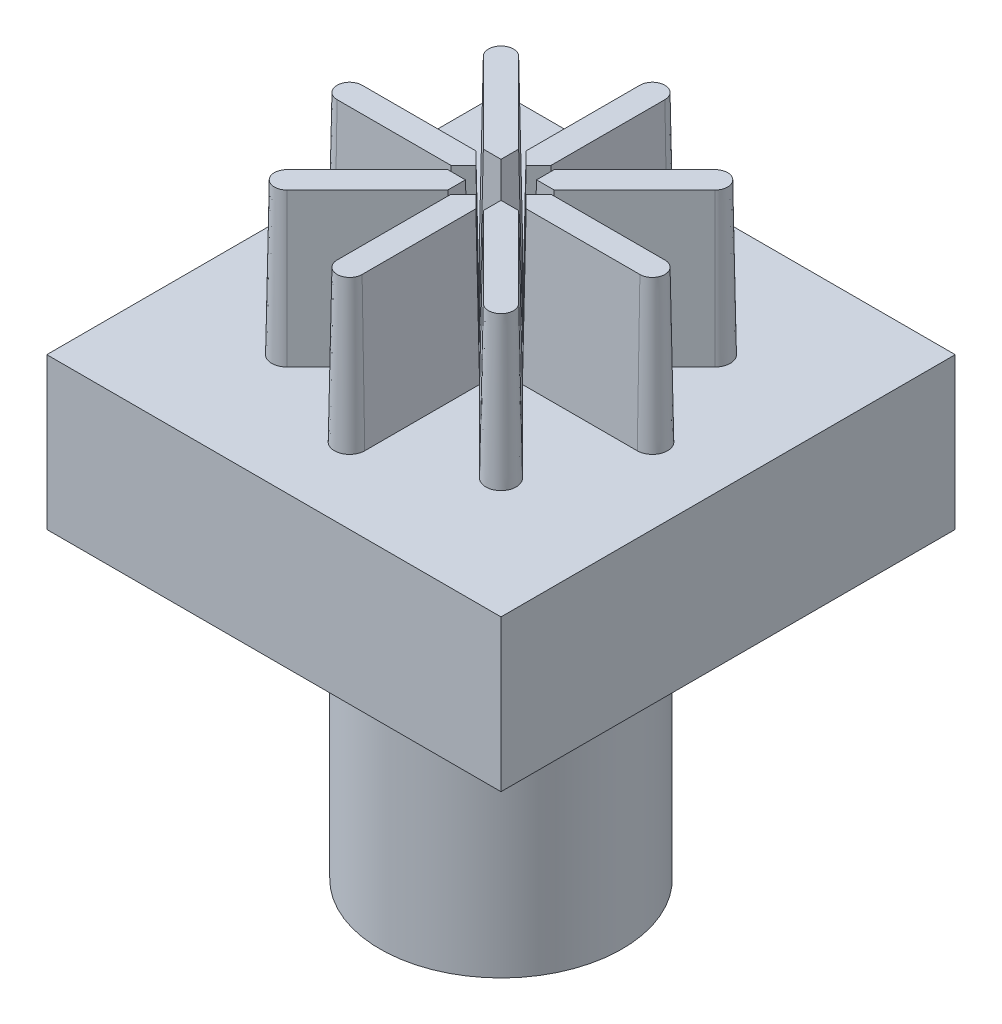
from build123d import *

# Parameters (mm, degrees)
SKETCH1_W                     = 15
SKETCH1_H                     = 15
BOSS_EXTRUDE1_DEPTH           = 5
BOSS_EXTRUDE2_DEPTH           = 5
BOSS_EXTRUDE2_DRAFT           = 1
BOSS_EXTRUDE2_PROFILE_2_DEPTH = 5
BOSS_EXTRUDE2_PROFILE_2_DRAFT = 1
BOSS_EXTRUDE2_PROFILE_3_DEPTH = 5
BOSS_EXTRUDE2_PROFILE_3_DRAFT = 1
BOSS_EXTRUDE2_PROFILE_4_DEPTH = 5
BOSS_EXTRUDE2_PROFILE_4_DRAFT = 1
BOSS_EXTRUDE2_PROFILE_5_DEPTH = 5
BOSS_EXTRUDE2_PROFILE_5_DRAFT = 1
BOSS_EXTRUDE2_PROFILE_6_DEPTH = 5
BOSS_EXTRUDE2_PROFILE_6_DRAFT = 1
BOSS_EXTRUDE2_PROFILE_7_DEPTH = 5
BOSS_EXTRUDE2_PROFILE_7_DRAFT = 1
BOSS_EXTRUDE2_PROFILE_8_DEPTH = 5
BOSS_EXTRUDE2_PROFILE_8_DRAFT = 1
SKETCH3_R                     = 4
BOSS_EXTRUDE3_DEPTH           = 10


with BuildPart() as part:
    # Sketch1 → Boss-Extrude1 (new body)
    with BuildSketch(Plane(origin=(0, 0, 0), x_dir=(1, 0, 0), z_dir=(0, 1, 0))):
        Rectangle(SKETCH1_W, SKETCH1_H)
    extrude(amount=BOSS_EXTRUDE1_DEPTH)

    # Sketch3 → Boss-Extrude3 (add)
    with BuildSketch(Plane.XZ):
        with Locations(Location((0, 0, 0), (0, 0, 270))):
            Circle(SKETCH3_R)
    extrude(amount=BOSS_EXTRUDE3_DEPTH)


with BuildPart() as body_2:
    # Sketch2 → Boss-Extrude2 (with draft: the straight prism first)
    with BuildSketch(Plane(origin=(0, 5, 0), x_dir=(1, 0, 0), z_dir=(0, 1, 0))):
        with BuildLine():
            Line((-0.5, 5), (-0.5, 1.207106781))
            Line((-0.5, 1.207106781), (0, 0.707106781))
            Line((0, 0.707106781), (0.5, 1.207106781))
            Line((0.5, 1.207106781), (0.5, 5))
            ThreePointArc((0.5, 5), (0, 5.5), (-0.5, 5))
        make_face()
    extrude(amount=BOSS_EXTRUDE2_DEPTH)
    # Boss-Extrude2: the draft: its side faces are tilted about the plane it starts from
    boss_extrude2_sides = [body_2.faces().sort_by_distance(p)[0] for p in [
        (0.5, 7.5, -3.103553391),
        (0, 7.5, -5.5),
        (-0.5, 7.5, -3.103553391),
        (-0.25, 7.5, -0.957106781),
        (0.25, 7.5, -0.957106781),
    ]]
    draft(boss_extrude2_sides, Plane(origin=(0, 5, 0), x_dir=(1, 0, 0), z_dir=(0, 1, 0)), BOSS_EXTRUDE2_DRAFT)


with BuildPart() as body_3:
    # Sketch2 → Boss-Extrude2 profile 2 (with draft: the straight prism first)
    with BuildSketch(Plane(origin=(0, 5, 0), x_dir=(1, 0, 0), z_dir=(0, 1, 0))):
        with BuildLine():
            Line((3.181980515, 3.889087297), (0.5, 1.207106781))
            Line((0.5, 1.207106781), (0.5, 0.5))
            Line((0.5, 0.5), (1.207106781, 0.5))
            Line((1.207106781, 0.5), (3.889087297, 3.181980515))
            ThreePointArc((3.889087297, 3.181980515), (3.889087297, 3.889087297), (3.181980515, 3.889087297))
        make_face()
    extrude(amount=BOSS_EXTRUDE2_PROFILE_2_DEPTH)
    # Boss-Extrude2 profile 2: the draft: its side faces are tilted about the plane it starts from
    boss_extrude2_profile_2_sides = [body_3.faces().sort_by_distance(p)[0] for p in [
        (2.548097039, 7.5, -1.840990258),
        (3.889087297, 7.5, -3.889087297),
        (1.840990258, 7.5, -2.548097039),
        (0.5, 7.5, -0.853553391),
        (0.853553391, 7.5, -0.5),
    ]]
    draft(boss_extrude2_profile_2_sides, Plane(origin=(0, 5, 0), x_dir=(1, 0, 0), z_dir=(0, 1, 0)), BOSS_EXTRUDE2_PROFILE_2_DRAFT)


with BuildPart() as body_4:
    # Sketch2 → Boss-Extrude2 profile 3 (with draft: the straight prism first)
    with BuildSketch(Plane(origin=(0, 5, 0), x_dir=(1, 0, 0), z_dir=(0, 1, 0))):
        with BuildLine():
            Line((1.207106781, 0.5), (0.707106781, 0))
            Line((0.707106781, 0), (1.207106781, -0.5))
            Line((1.207106781, -0.5), (5, -0.5))
            ThreePointArc((5, -0.5), (5.5, 0), (5, 0.5))
            Line((5, 0.5), (1.207106781, 0.5))
        make_face()
    extrude(amount=BOSS_EXTRUDE2_PROFILE_3_DEPTH)
    # Boss-Extrude2 profile 3: the draft: its side faces are tilted about the plane it starts from
    boss_extrude2_profile_3_sides = [body_4.faces().sort_by_distance(p)[0] for p in [
        (0.957106781, 7.5, -0.25),
        (0.957106781, 7.5, 0.25),
        (3.103553391, 7.5, 0.5),
        (5.5, 7.5, 0),
        (3.103553391, 7.5, -0.5),
    ]]
    draft(boss_extrude2_profile_3_sides, Plane(origin=(0, 5, 0), x_dir=(1, 0, 0), z_dir=(0, 1, 0)), BOSS_EXTRUDE2_PROFILE_3_DRAFT)


with BuildPart() as body_5:
    # Sketch2 → Boss-Extrude2 profile 4 (with draft: the straight prism first)
    with BuildSketch(Plane(origin=(0, 5, 0), x_dir=(1, 0, 0), z_dir=(0, 1, 0))):
        with BuildLine():
            Line((1.207106781, -0.5), (0.5, -0.5))
            Line((0.5, -0.5), (0.5, -1.207106781))
            Line((0.5, -1.207106781), (3.181980515, -3.889087297))
            ThreePointArc((3.181980515, -3.889087297), (3.889087297, -3.889087297), (3.889087297, -3.181980515))
            Line((3.889087297, -3.181980515), (1.207106781, -0.5))
        make_face()
    extrude(amount=BOSS_EXTRUDE2_PROFILE_4_DEPTH)
    # Boss-Extrude2 profile 4: the draft: its side faces are tilted about the plane it starts from
    boss_extrude2_profile_4_sides = [body_5.faces().sort_by_distance(p)[0] for p in [
        (0.853553391, 7.5, 0.5),
        (0.5, 7.5, 0.853553391),
        (1.840990258, 7.5, 2.548097039),
        (3.889087297, 7.5, 3.889087297),
        (2.548097039, 7.5, 1.840990258),
    ]]
    draft(boss_extrude2_profile_4_sides, Plane(origin=(0, 5, 0), x_dir=(1, 0, 0), z_dir=(0, 1, 0)), BOSS_EXTRUDE2_PROFILE_4_DRAFT)


with BuildPart() as body_6:
    # Sketch2 → Boss-Extrude2 profile 5 (with draft: the straight prism first)
    with BuildSketch(Plane(origin=(0, 5, 0), x_dir=(1, 0, 0), z_dir=(0, 1, 0))):
        with BuildLine():
            Line((0, -0.707106781), (-0.5, -1.207106781))
            Line((-0.5, -1.207106781), (-0.5, -5))
            ThreePointArc((-0.5, -5), (0, -5.5), (0.5, -5))
            Line((0.5, -5), (0.5, -1.207106781))
            Line((0.5, -1.207106781), (0, -0.707106781))
        make_face()
    extrude(amount=BOSS_EXTRUDE2_PROFILE_5_DEPTH)
    # Boss-Extrude2 profile 5: the draft: its side faces are tilted about the plane it starts from
    boss_extrude2_profile_5_sides = [body_6.faces().sort_by_distance(p)[0] for p in [
        (0.25, 7.5, 0.957106781),
        (-0.25, 7.5, 0.957106781),
        (-0.5, 7.5, 3.103553391),
        (0, 7.5, 5.5),
        (0.5, 7.5, 3.103553391),
    ]]
    draft(boss_extrude2_profile_5_sides, Plane(origin=(0, 5, 0), x_dir=(1, 0, 0), z_dir=(0, 1, 0)), BOSS_EXTRUDE2_PROFILE_5_DRAFT)


with BuildPart() as body_7:
    # Sketch2 → Boss-Extrude2 profile 6 (with draft: the straight prism first)
    with BuildSketch(Plane(origin=(0, 5, 0), x_dir=(1, 0, 0), z_dir=(0, 1, 0))):
        with BuildLine():
            Line((-0.5, -1.207106781), (-0.5, -0.5))
            Line((-0.5, -0.5), (-1.207106781, -0.5))
            Line((-1.207106781, -0.5), (-3.889087297, -3.181980515))
            ThreePointArc((-3.889087297, -3.181980515), (-3.889087297, -3.889087297), (-3.181980515, -3.889087297))
            Line((-3.181980515, -3.889087297), (-0.5, -1.207106781))
        make_face()
    extrude(amount=BOSS_EXTRUDE2_PROFILE_6_DEPTH)
    # Boss-Extrude2 profile 6: the draft: its side faces are tilted about the plane it starts from
    boss_extrude2_profile_6_sides = [body_7.faces().sort_by_distance(p)[0] for p in [
        (-0.5, 7.5, 0.853553391),
        (-0.853553391, 7.5, 0.5),
        (-2.548097039, 7.5, 1.840990258),
        (-3.889087297, 7.5, 3.889087297),
        (-1.840990258, 7.5, 2.548097039),
    ]]
    draft(boss_extrude2_profile_6_sides, Plane(origin=(0, 5, 0), x_dir=(1, 0, 0), z_dir=(0, 1, 0)), BOSS_EXTRUDE2_PROFILE_6_DRAFT)


with BuildPart() as body_8:
    # Sketch2 → Boss-Extrude2 profile 7 (with draft: the straight prism first)
    with BuildSketch(Plane(origin=(0, 5, 0), x_dir=(1, 0, 0), z_dir=(0, 1, 0))):
        with BuildLine():
            Line((-1.207106781, -0.5), (-0.707106781, 0))
            Line((-0.707106781, 0), (-1.207106781, 0.5))
            Line((-1.207106781, 0.5), (-5, 0.5))
            ThreePointArc((-5, 0.5), (-5.5, 0), (-5, -0.5))
            Line((-5, -0.5), (-1.207106781, -0.5))
        make_face()
    extrude(amount=BOSS_EXTRUDE2_PROFILE_7_DEPTH)
    # Boss-Extrude2 profile 7: the draft: its side faces are tilted about the plane it starts from
    boss_extrude2_profile_7_sides = [body_8.faces().sort_by_distance(p)[0] for p in [
        (-5.5, 7.5, 0),
        (-3.103553391, 7.5, 0.5),
        (-0.957106781, 7.5, 0.25),
        (-0.957106781, 7.5, -0.25),
        (-3.103553391, 7.5, -0.5),
    ]]
    draft(boss_extrude2_profile_7_sides, Plane(origin=(0, 5, 0), x_dir=(1, 0, 0), z_dir=(0, 1, 0)), BOSS_EXTRUDE2_PROFILE_7_DRAFT)


with BuildPart() as body_9:
    # Sketch2 → Boss-Extrude2 profile 8 (with draft: the straight prism first)
    with BuildSketch(Plane(origin=(0, 5, 0), x_dir=(1, 0, 0), z_dir=(0, 1, 0))):
        with BuildLine():
            Line((-1.207106781, 0.5), (-0.5, 0.5))
            Line((-0.5, 0.5), (-0.5, 1.207106781))
            Line((-0.5, 1.207106781), (-3.181980515, 3.889087297))
            ThreePointArc((-3.181980515, 3.889087297), (-3.889087297, 3.889087297), (-3.889087297, 3.181980515))
            Line((-3.889087297, 3.181980515), (-1.207106781, 0.5))
        make_face()
    extrude(amount=BOSS_EXTRUDE2_PROFILE_8_DEPTH)
    # Boss-Extrude2 profile 8: the draft: its side faces are tilted about the plane it starts from
    boss_extrude2_profile_8_sides = [body_9.faces().sort_by_distance(p)[0] for p in [
        (-0.853553391, 7.5, -0.5),
        (-0.5, 7.5, -0.853553391),
        (-1.840990258, 7.5, -2.548097039),
        (-3.889087297, 7.5, -3.889087297),
        (-2.548097039, 7.5, -1.840990258),
    ]]
    draft(boss_extrude2_profile_8_sides, Plane(origin=(0, 5, 0), x_dir=(1, 0, 0), z_dir=(0, 1, 0)), BOSS_EXTRUDE2_PROFILE_8_DRAFT)


solid = Compound([part.part, body_2.part, body_3.part, body_4.part, body_5.part, body_6.part, body_7.part, body_8.part, body_9.part])
